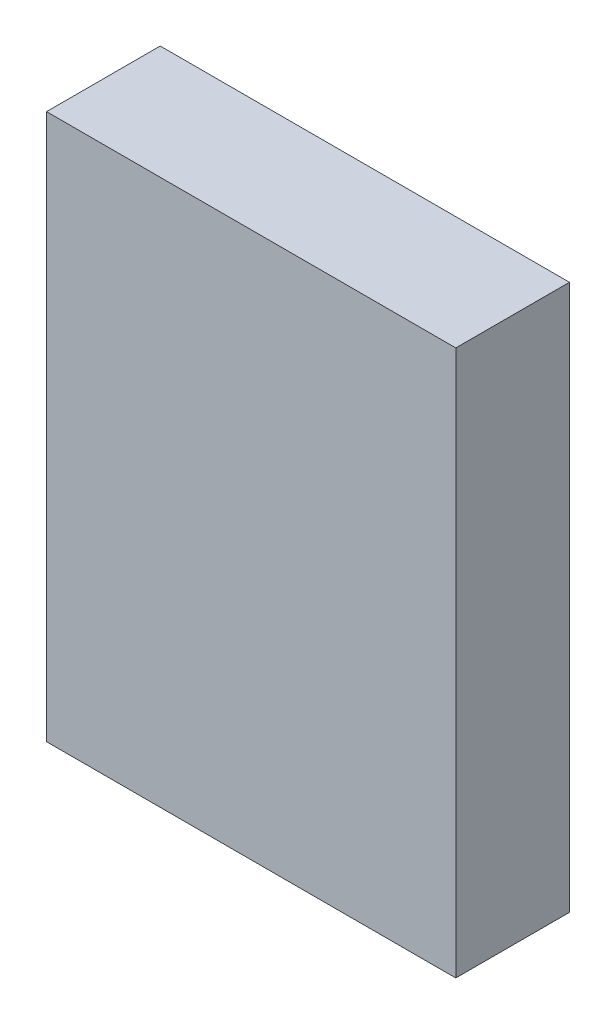
from build123d import *

# Parameters (mm, degrees)
SKETCH1_W           = 18
SKETCH1_H           = 24
BOSS_EXTRUDE1_DEPTH = 5


with BuildPart() as part:
    # Sketch1 → Boss-Extrude1 (new body)
    with BuildSketch(Plane.XY):
        with Locations((-142.774258543, -5.088451674)):
            Rectangle(SKETCH1_W, SKETCH1_H)
    extrude(amount=BOSS_EXTRUDE1_DEPTH)


solid = part.part
